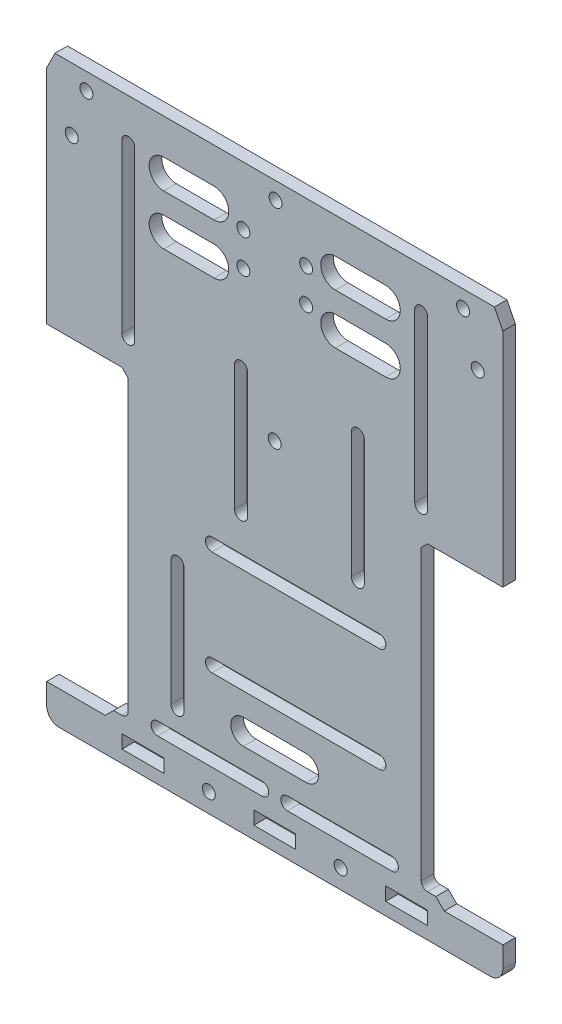
from build123d import *

# Parameters (mm, degrees)
ESBO_O1_R                = 1.55
ESBO_O1_W                = 10
ESBO_O1_H                = 3.2
RESSALTO_EXTRUS_O1_DEPTH = 3
ESBO_O2_R                = 1.55
CORTE_EXTRUS_O1_DEPTH    = 177.666352201
ESBO_O3_R                = 1.55
CORTE_EXTRUS_O2_DEPTH    = 10


with BuildPart() as part:
    # Esboço1 → Ressalto-extrusão1 (new body)
    with BuildSketch(Plane.XY):
        with BuildLine():
            Line((0, 82), (0, 135))
            Line((0, 135), (2, 139))
            Line((2, 139), (107, 139))
            Line((107, 139), (109, 135))
            Line((109, 135), (109, 82))
            Line((109, 82), (91, 82))
            Line((91, 82), (89.5, 80.5))
            Line((89.5, 80.5), (89.5, 11.5))
            ThreePointArc((89.5, 11.5), (89.939339828, 10.439339828), (91, 10))
            Line((91, 10), (93, 10))
            Line((93, 10), (95, 8))
            Line((95, 8), (109, 8))
            Line((109, 8), (109, 3))
            ThreePointArc((109, 3), (108.121320344, 0.878679656), (106, 0))
            Line((106, 0), (3, 0))
            ThreePointArc((3, 0), (0.878679656, 0.878679656), (0, 3))
            Line((0, 3), (0, 8))
            Line((0, 8), (14, 8))
            Line((14, 8), (16, 10))
            Line((16, 10), (18, 10))
            ThreePointArc((18, 10), (19.060660172, 10.439339828), (19.5, 11.5))
            Line((19.5, 11.5), (19.5, 80.5))
            Line((19.5, 80.5), (18, 82))
            Line((18, 82), (0, 82))
        make_face()
        with Locations((38.75, 4.6)):
            Circle(ESBO_O1_R, mode=Mode.SUBTRACT)
        with Locations((70.25, 4.6)):
            Circle(ESBO_O1_R, mode=Mode.SUBTRACT)
        with Locations((54.5, 85)):
            Circle(ESBO_O1_R, mode=Mode.SUBTRACT)
        with Locations((6, 124)):
            Circle(ESBO_O1_R, mode=Mode.SUBTRACT)
        with Locations((103, 124)):
            Circle(ESBO_O1_R, mode=Mode.SUBTRACT)
        with Locations((23, 4.6)):
            Rectangle(ESBO_O1_W, ESBO_O1_H, mode=Mode.SUBTRACT)
        with Locations((54.5, 4.6)):
            Rectangle(ESBO_O1_W, ESBO_O1_H, mode=Mode.SUBTRACT)
        with Locations((86, 4.6)):
            Rectangle(ESBO_O1_W, ESBO_O1_H, mode=Mode.SUBTRACT)
        with BuildLine():
            Line((26.5, 13.1), (51.5, 13.1))
            ThreePointArc((51.5, 13.1), (53.05, 11.55), (51.5, 10))
            Line((51.5, 10), (26.5, 10))
            ThreePointArc((26.5, 10), (24.95, 11.55), (26.5, 13.1))
        make_face(mode=Mode.SUBTRACT)
        with BuildLine():
            Line((57.5, 13.1), (82.5, 13.1))
            ThreePointArc((82.5, 13.1), (84.05, 11.55), (82.5, 10))
            Line((82.5, 10), (57.5, 10))
            ThreePointArc((57.5, 10), (55.95, 11.55), (57.5, 13.1))
        make_face(mode=Mode.SUBTRACT)
    extrude(amount=RESSALTO_EXTRUS_O1_DEPTH)

    # Esboço2 → Corte-extrusão1 (cut, through all)
    with BuildSketch(Plane.XY.offset(3)):
        with Locations((47, 117)):
            Circle(ESBO_O2_R)
        with Locations((47, 125)):
            Circle(ESBO_O2_R)
        with Locations((62, 117)):
            Circle(ESBO_O2_R)
        with Locations((62, 125)):
            Circle(ESBO_O2_R)
        with BuildLine():
            Line((47, 24.1), (62, 24.1))
            ThreePointArc((62, 24.1), (65, 21.1), (62, 18.1))
            Line((62, 18.1), (47, 18.1))
            ThreePointArc((47, 18.1), (44, 21.1), (47, 24.1))
        make_face()
        with BuildLine():
            Line((21.05, 129), (21.05, 89))
            ThreePointArc((21.05, 89), (19.5, 87.45), (17.95, 89))
            Line((17.95, 89), (17.95, 129))
            ThreePointArc((17.95, 129), (19.5, 130.55), (21.05, 129))
        make_face()
        with BuildLine():
            Line((29.7, 18.1), (29.7, 48.1))
            ThreePointArc((29.7, 48.1), (31.25, 49.65), (32.8, 48.1))
            Line((32.8, 48.1), (32.8, 18.1))
            ThreePointArc((32.8, 18.1), (31.25, 16.55), (29.7, 18.1))
        make_face()
        with BuildLine():
            Line((75.9, 96.1), (75.9, 66.1))
            ThreePointArc((75.9, 66.1), (74.35, 64.55), (72.8, 66.1))
            Line((72.8, 66.1), (72.8, 96.1))
            ThreePointArc((72.8, 96.1), (74.35, 97.65), (75.9, 96.1))
        make_face()
        with BuildLine():
            Line((48, 96.1), (48, 66.1))
            ThreePointArc((48, 66.1), (46.45, 64.55), (44.9, 66.1))
            Line((44.9, 66.1), (44.9, 96.1))
            ThreePointArc((44.9, 96.1), (46.45, 97.65), (48, 96.1))
        make_face()
        with BuildLine():
            Line((28, 118.5), (40, 118.5))
            ThreePointArc((40, 118.5), (43.5, 115), (40, 111.5))
            Line((40, 111.5), (28, 111.5))
            ThreePointArc((28, 111.5), (24.5, 115), (28, 118.5))
        make_face()
        with BuildLine():
            Line((28, 130.5), (40, 130.5))
            ThreePointArc((40, 130.5), (43.5, 127), (40, 123.5))
            Line((40, 123.5), (28, 123.5))
            ThreePointArc((28, 123.5), (24.5, 127), (28, 130.5))
        make_face()
        with BuildLine():
            Line((91.05, 129), (91.05, 89))
            ThreePointArc((91.05, 89), (89.5, 87.45), (87.95, 89))
            Line((87.95, 89), (87.95, 129))
            ThreePointArc((87.95, 129), (89.5, 130.55), (91.05, 129))
        make_face()
        with BuildLine():
            Line((69, 118.5), (81, 118.5))
            ThreePointArc((81, 118.5), (84.5, 115), (81, 111.5))
            Line((81, 111.5), (69, 111.5))
            ThreePointArc((69, 111.5), (65.5, 115), (69, 118.5))
        make_face()
        with BuildLine():
            Line((69, 130.5), (81, 130.5))
            ThreePointArc((81, 130.5), (84.5, 127), (81, 123.5))
            Line((81, 123.5), (69, 123.5))
            ThreePointArc((69, 123.5), (65.5, 127), (69, 130.5))
        make_face()
        with BuildLine():
            Line((39.5, 32.65), (79.5, 32.65))
            ThreePointArc((79.5, 32.65), (81.05, 31.1), (79.5, 29.55))
            Line((79.5, 29.55), (39.5, 29.55))
            ThreePointArc((39.5, 29.55), (37.95, 31.1), (39.5, 32.65))
        make_face()
        with BuildLine():
            Line((39.5, 57.65), (79.5, 57.65))
            ThreePointArc((79.5, 57.65), (81.05, 56.1), (79.5, 54.55))
            Line((79.5, 54.55), (39.5, 54.55))
            ThreePointArc((39.5, 54.55), (37.95, 56.1), (39.5, 57.65))
        make_face()
    extrude(amount=-CORTE_EXTRUS_O1_DEPTH, mode=Mode.SUBTRACT)

    # Esboço3 → Corte-extrusão2 (cut)
    with BuildSketch(Plane.XY.offset(3)):
        with Locations((54.693176617, 134.937304028)):
            Circle(ESBO_O3_R)
        with Locations((9.5, 134.937304028)):
            Circle(ESBO_O3_R)
        with Locations((99.5, 134.937304028)):
            Circle(ESBO_O3_R)
    extrude(amount=-CORTE_EXTRUS_O2_DEPTH, mode=Mode.SUBTRACT)


solid = part.part
